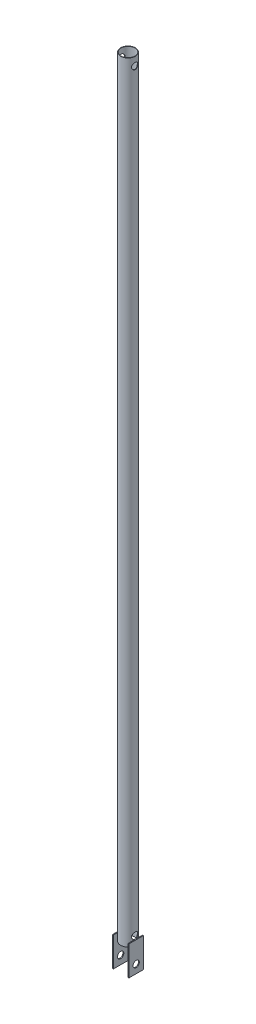
from build123d import *

# Parameters (mm, degrees)
SKETCH1_R                  = 17.46
SKETCH1_R_2                = 16.46
BOSS_EXTRUDE1_DEPTH        = 1828.8
CUT_EXTRUDE1_DEPTH         = 1829.966687285
CUT_EXTRUDE1_DEPTH_BACK    = 1829.966687285
SKETCH2_R                  = 7.5
BOSS_EXTRUDE2_DEPTH        = 17.46
BOSS_EXTRUDE2_DEPTH_BACK   = 17.46
SKETCH3_W                  = 2
SKETCH3_H                  = 70
BOSS_EXTRUDE2_2_DEPTH      = 17.46
BOSS_EXTRUDE2_2_DEPTH_BACK = 17.46
CUT_EXTRUDE2_DEPTH         = 1830.297422064
CUT_EXTRUDE2_DEPTH_BACK    = 1830.297422064
SKETCH4_R                  = 7.5


with BuildPart() as part:
    # Sketch1 → Boss-Extrude1 (new body)
    with BuildSketch(Plane(origin=(0, 0, 0), x_dir=(1, 0, 0), z_dir=(0, 1, 0))):
        Circle(SKETCH1_R)
        Circle(SKETCH1_R_2, mode=Mode.SUBTRACT)
    extrude(amount=BOSS_EXTRUDE1_DEPTH)

    # Sketch2 → Cut-Extrude1 (cut, two sides: drawn at the far end of the back side and taken through both)
    with BuildSketch(Plane(origin=(0, 0, 0), x_dir=(0, 0, -1), z_dir=(1, 0, 0)).offset(-CUT_EXTRUDE1_DEPTH_BACK)):
        with Locations((0, 1808.8)):
            Circle(SKETCH2_R)
        with Locations((0, 20)):
            Circle(SKETCH2_R)
    extrude(amount=CUT_EXTRUDE1_DEPTH + CUT_EXTRUDE1_DEPTH_BACK, mode=Mode.SUBTRACT)


with BuildPart() as body_2:
    # Sketch3 → Boss-Extrude2 (new, two sides: drawn at the far end of the back side and taken through both)
    with BuildSketch(Plane.XY.offset(-BOSS_EXTRUDE2_DEPTH_BACK)):
        with Locations((-18.46, -22.5)):
            Rectangle(SKETCH3_W, SKETCH3_H)
    extrude(amount=BOSS_EXTRUDE2_DEPTH + BOSS_EXTRUDE2_DEPTH_BACK)


with BuildPart() as body_3:
    # Sketch3 → Boss-Extrude2 2 (new, two sides: drawn at the far end of the back side and taken through both)
    with BuildSketch(Plane.XY.offset(-BOSS_EXTRUDE2_2_DEPTH_BACK)):
        with Locations((18.46, -22.5)):
            Rectangle(SKETCH3_W, SKETCH3_H)
    extrude(amount=BOSS_EXTRUDE2_2_DEPTH + BOSS_EXTRUDE2_2_DEPTH_BACK)


with BuildPart() as cut_extrude2_tool:
    # Sketch4 → Cut-Extrude2 (new, two sides: drawn at the far end of the back side and taken through both)
    with BuildSketch(Plane(origin=(19.46, 0, 0), x_dir=(0, 0, -1), z_dir=(1, 0, 0)).offset(-CUT_EXTRUDE2_DEPTH_BACK)):
        with Locations((0, -37.5)):
            Circle(SKETCH4_R)
    extrude(amount=CUT_EXTRUDE2_DEPTH + CUT_EXTRUDE2_DEPTH_BACK)


with BuildPart() as body_2_1:
    add(body_2.part)

    # Cut-Extrude2: cut by cut_extrude2_tool
    add(cut_extrude2_tool.part, mode=Mode.SUBTRACT)


with BuildPart() as body_3_1:
    add(body_3.part)

    # Cut-Extrude2: cut by cut_extrude2_tool
    add(cut_extrude2_tool.part, mode=Mode.SUBTRACT)


solid = Compound([part.part, body_2_1.part, body_3_1.part])
